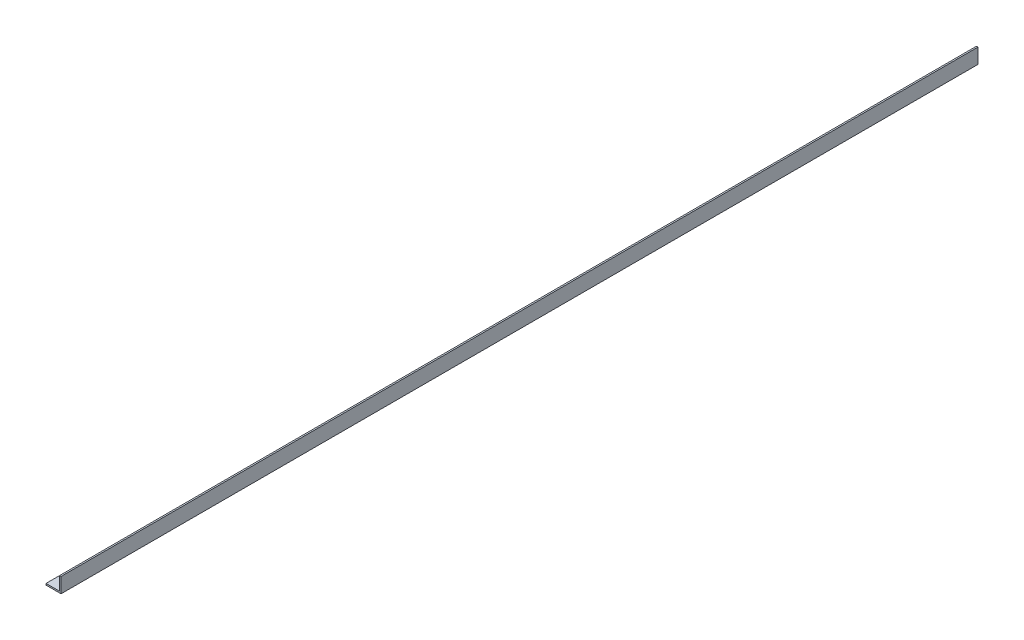
from build123d import *

# Parameters (mm, degrees)
BOSS_EXTRUDE1_DEPTH      = 304.8
BOSS_EXTRUDE1_DEPTH_BACK = 304.8


with BuildPart() as part:
    # Sketch3 → Boss-Extrude1 (new, two sides: drawn at the far end of the back side and taken through both)
    with BuildSketch(Plane.XY.offset(-BOSS_EXTRUDE1_DEPTH_BACK)):
        Polygon((-10, 0), (0, 0), (0, 10), (-1, 10), (-1, 1), (-10, 1), align=None)
    extrude(amount=BOSS_EXTRUDE1_DEPTH + BOSS_EXTRUDE1_DEPTH_BACK)


solid = part.part
